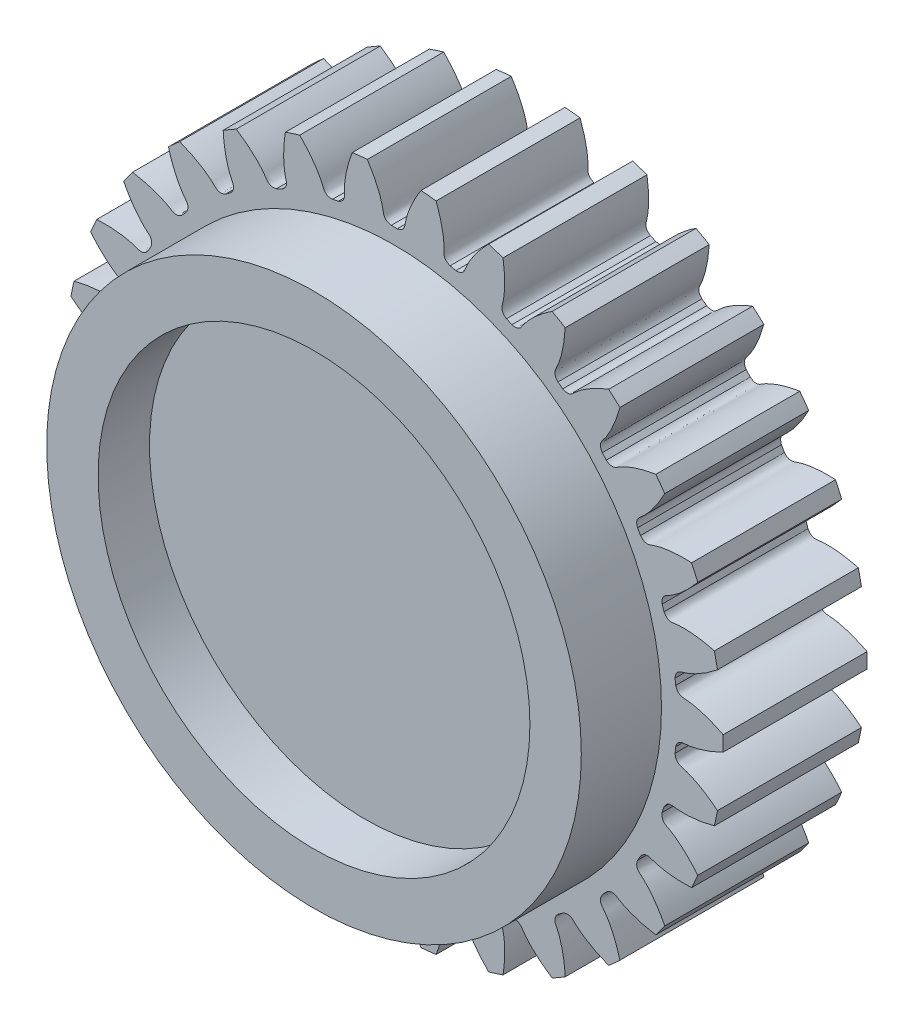
from build123d import *

# Parameters (mm, degrees)
SKETCH_1_R               = 16
EXTRUDE_1_DEPTH          = 7
CUT_EXTRUDE_1_DEPTH      = 24.685438565
PATTERN_CIRCULAR_1_COUNT = 30
SKETCH_5_R               = 13
EXTRUDE_3_DEPTH          = 1.4
SKETCH_4_R               = 13
SKETCH_4_R_2             = 10.5
EXTRUDE_2_DEPTH          = 2.5


with BuildPart() as part:
    # 草图1 → 凸台-拉伸1 (new body)
    with BuildSketch(Plane.XY):
        Circle(SKETCH_1_R)
    extrude(amount=EXTRUDE_1_DEPTH)

    # 草图2 → 切除-拉伸1 (cut, through all)
    with BuildSketch(Plane.XY):
        with BuildLine():
            ThreePointArc((0.145558629, 13.749229531), (0, 13.75), (-0.145558629, 13.749229531))
            add(Edge.make_bspline(
                [(-0.145558629, 13.749229531), (-0.50823069, 13.81297517), (-0.510304747, 14.047132636), (-0.55898482, 14.288579015), (-0.569950741, 14.338129238), (-0.583247086, 14.392924909), (-0.599067717, 14.452897992), (-0.617630624, 14.517964907), (-0.639143358, 14.588038514), (-0.663813512, 14.663024477), (-0.691845294, 14.742822461), (-0.723440342, 14.827325855), (-0.758797267, 14.91642195), (-0.798111576, 15.009991983), (-0.841575482, 15.107911227), (-0.889377751, 15.210049075), (-0.941703547, 15.316269128), (-0.99873427, 15.426429286), (-1.060647407, 15.54038185), (-1.127616379, 15.657973616), (-1.199810393, 15.779045984), (-1.277394296, 15.903435064), (-1.36052843, 16.030971789), (-1.449368495, 16.161482028), (-1.544065407, 16.294786707), (-1.644765164, 16.430701934), (-1.751608718, 16.569039116), (-1.864731839, 16.709605098), (-1.984264996, 16.85220229), (-2.110333232, 16.996628804), (-2.243056043, 17.14267859), (-2.382547265, 17.290141584), (-2.528914958, 17.438803847), (-2.682261311, 17.588447714), (-2.842682483, 17.738851945), (-3.068923866, 17.942620828), (-3.245344618, 18.092071531), (-3.366311832, 18.190558123)],
                knots=[0, 0, 0, 0, 0.115323882, 0.12341257, 0.132512303, 0.142623081, 0.153744905, 0.165877774, 0.179021689, 0.193176649, 0.208342655, 0.224519706, 0.241707802, 0.259906945, 0.279117132, 0.299338365, 0.320570644, 0.342813968, 0.366068337, 0.390333752, 0.415610213, 0.441897719, 0.46919627, 0.497505867, 0.52682651, 0.557158198, 0.588500931, 0.62085471, 0.654219534, 0.688595404, 0.723982319, 0.76038028, 0.797789286, 0.836209338, 0.875640435, 0.916082578, 1, 1, 1, 1], degree=3))
            ThreePointArc((-3.366311832, 18.190558123), (0, 18.499417833), (3.366311832, 18.190558123))
            add(Edge.make_bspline(
                [(0.145558629, 13.749229531), (0.50823069, 13.81297517), (0.510304747, 14.047132636), (0.55898482, 14.288579015), (0.569950741, 14.338129238), (0.583247086, 14.392924909), (0.599067717, 14.452897992), (0.617630624, 14.517964907), (0.639143358, 14.588038514), (0.663813512, 14.663024477), (0.691845294, 14.742822461), (0.723440342, 14.827325855), (0.758797267, 14.91642195), (0.798111576, 15.009991983), (0.841575482, 15.107911227), (0.889377751, 15.210049075), (0.941703547, 15.316269128), (0.99873427, 15.426429286), (1.060647407, 15.54038185), (1.127616379, 15.657973616), (1.199810393, 15.779045984), (1.277394296, 15.903435064), (1.36052843, 16.030971789), (1.449368495, 16.161482028), (1.544065407, 16.294786707), (1.644765164, 16.430701934), (1.751608718, 16.569039116), (1.864731839, 16.709605098), (1.984264996, 16.85220229), (2.110333232, 16.996628804), (2.243056043, 17.14267859), (2.382547265, 17.290141584), (2.528914958, 17.438803847), (2.682261311, 17.588447714), (2.842682483, 17.738851945), (3.068923866, 17.942620828), (3.245344618, 18.092071531), (3.366311832, 18.190558123)],
                knots=[0, 0, 0, 0, 0.115323882, 0.12341257, 0.132512303, 0.142623081, 0.153744905, 0.165877774, 0.179021689, 0.193176649, 0.208342655, 0.224519706, 0.241707802, 0.259906945, 0.279117132, 0.299338365, 0.320570644, 0.342813968, 0.366068337, 0.390333752, 0.415610213, 0.441897719, 0.46919627, 0.497505867, 0.52682651, 0.557158198, 0.588500931, 0.62085471, 0.654219534, 0.688595404, 0.723982319, 0.76038028, 0.797789286, 0.836209338, 0.875640435, 0.916082578, 1, 1, 1, 1], degree=3))
        make_face()
    cut_extrude_1 = extrude(amount=CUT_EXTRUDE_1_DEPTH, mode=Mode.SUBTRACT)

    # 阵列(圆周)1: 切除-拉伸1 ×30 about axis
    pattern_circular_1_axis = Axis((0, 0, -0.35), (0, 0, 1))
    for i in range(1, PATTERN_CIRCULAR_1_COUNT):
        add(cut_extrude_1.rotate(pattern_circular_1_axis, i * 360 / PATTERN_CIRCULAR_1_COUNT), mode=Mode.SUBTRACT)

    # 草图5 → 凸台-拉伸3 (add)
    with BuildSketch(Plane.XY.offset(7)):
        Circle(SKETCH_5_R)
    extrude(amount=EXTRUDE_3_DEPTH)

    # 草图4 → 凸台-拉伸2 (add)
    with BuildSketch(Plane.XY.offset(8.4)):
        Circle(SKETCH_4_R)
        Circle(SKETCH_4_R_2, mode=Mode.SUBTRACT)
    extrude(amount=EXTRUDE_2_DEPTH)


solid = part.part
